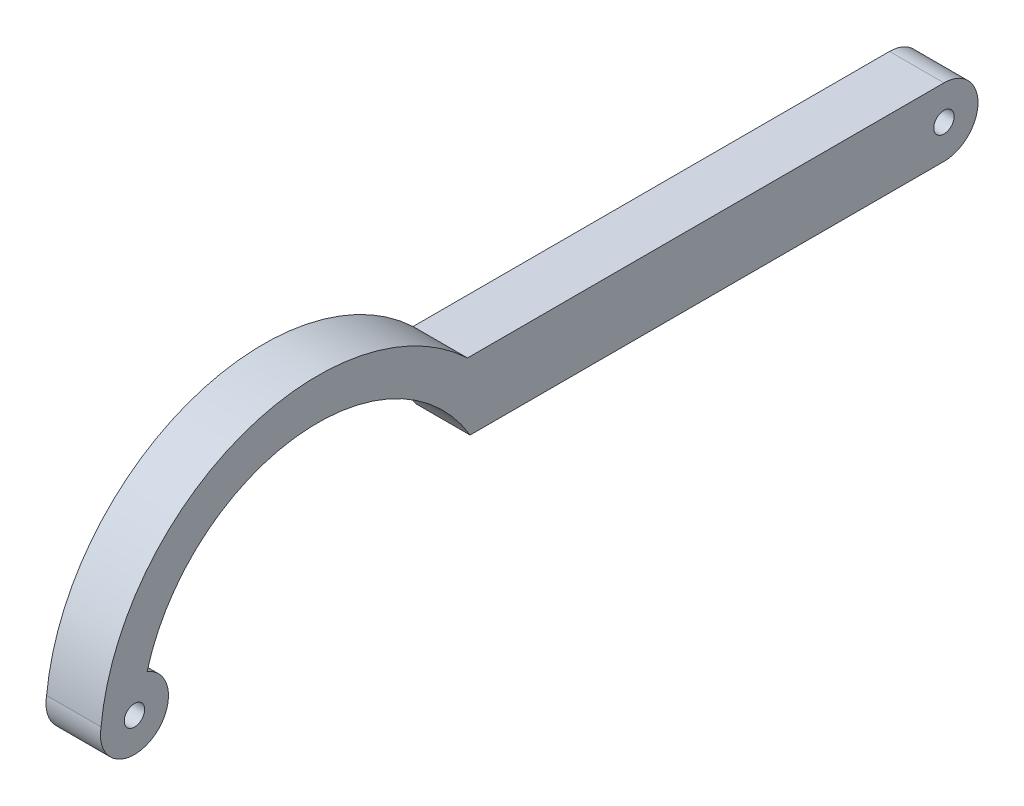
from build123d import *

# Parameters (mm, degrees)
SKETCH1_R           = 0.75
BOSS_EXTRUDE1_DEPTH = 4


with BuildPart() as part:
    # Sketch1 → Boss-Extrude1 (new body)
    with BuildSketch(Plane(origin=(0, 0, 0), x_dir=(0, 0, -1), z_dir=(1, 0, 0))):
        with BuildLine():
            Line((59.464274989, 10.5), (24.464274989, 10.5))
            ThreePointArc((24.464274989, 10.5), (7.885689727, 13.874194792), (-2.453052661, 0.482216385))
            ThreePointArc((-2.453052661, 0.482216385), (1.193550555, -2.19668775), (0.930226833, 2.320490905))
            ThreePointArc((0.930226833, 2.320490905), (11.73957945, 11.763813024), (24.654031937, 5.5))
            Line((24.654031937, 5.5), (59.464274989, 5.5))
            ThreePointArc((59.464274989, 5.5), (61.964274989, 8), (59.464274989, 10.5))
        make_face()
        with Locations((59.464274989, 8)):
            Circle(SKETCH1_R, mode=Mode.SUBTRACT)
        Circle(SKETCH1_R, mode=Mode.SUBTRACT)
    extrude(amount=BOSS_EXTRUDE1_DEPTH)


solid = part.part
